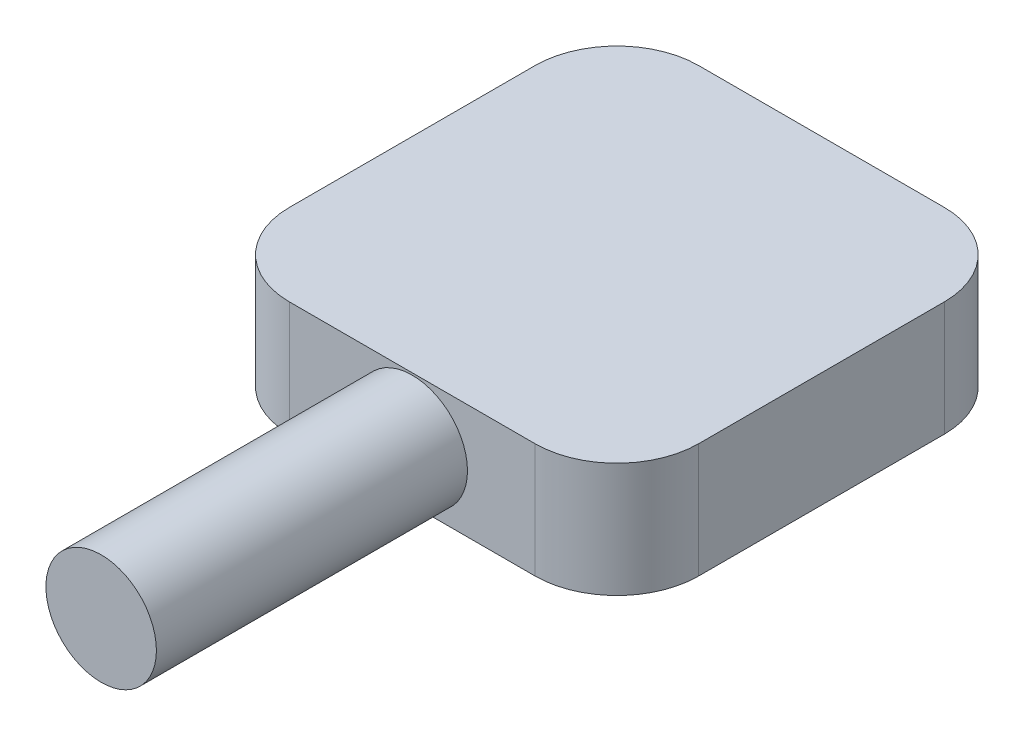
from build123d import *

# Parameters (mm, degrees)
BOSS_EXTRUDE1_DEPTH      = 10
BOSS_EXTRUDE1_DEPTH_BACK = 73
SKETCH1_R                = 6.75
BOSS_EXTRUDE2_DEPTH      = 7
BOSS_EXTRUDE2_DEPTH_BACK = 7


with BuildPart() as part:
    # Sketch1 → Boss-Extrude1 (new, two sides: drawn at the far end of the back side and taken through both)
    with BuildSketch(Plane.XY.offset(-BOSS_EXTRUDE1_DEPTH_BACK)):
        Circle(SKETCH1_R)
    extrude(amount=BOSS_EXTRUDE1_DEPTH + BOSS_EXTRUDE1_DEPTH_BACK)

    # Sketch2 → Boss-Extrude2 (add, two sides: drawn at the far end of the back side and taken through both)
    with BuildSketch(Plane(origin=(0, 0, 0), x_dir=(-1, 0, 0), z_dir=(0, 1, 0)).offset(-BOSS_EXTRUDE2_DEPTH_BACK)):
        with BuildLine():
            Line((-15, -78), (15, -78))
            ThreePointArc((15, -78), (22.071067812, -75.071067812), (25, -68))
            Line((25, -68), (25, -38))
            ThreePointArc((25, -38), (22.071067812, -30.928932188), (15, -28))
            Line((15, -28), (-15, -28))
            ThreePointArc((-15, -28), (-22.071067812, -30.928932188), (-25, -38))
            Line((-25, -38), (-25, -68))
            ThreePointArc((-25, -68), (-22.071067812, -75.071067812), (-15, -78))
        make_face()
    extrude(amount=BOSS_EXTRUDE2_DEPTH + BOSS_EXTRUDE2_DEPTH_BACK)


solid = part.part
